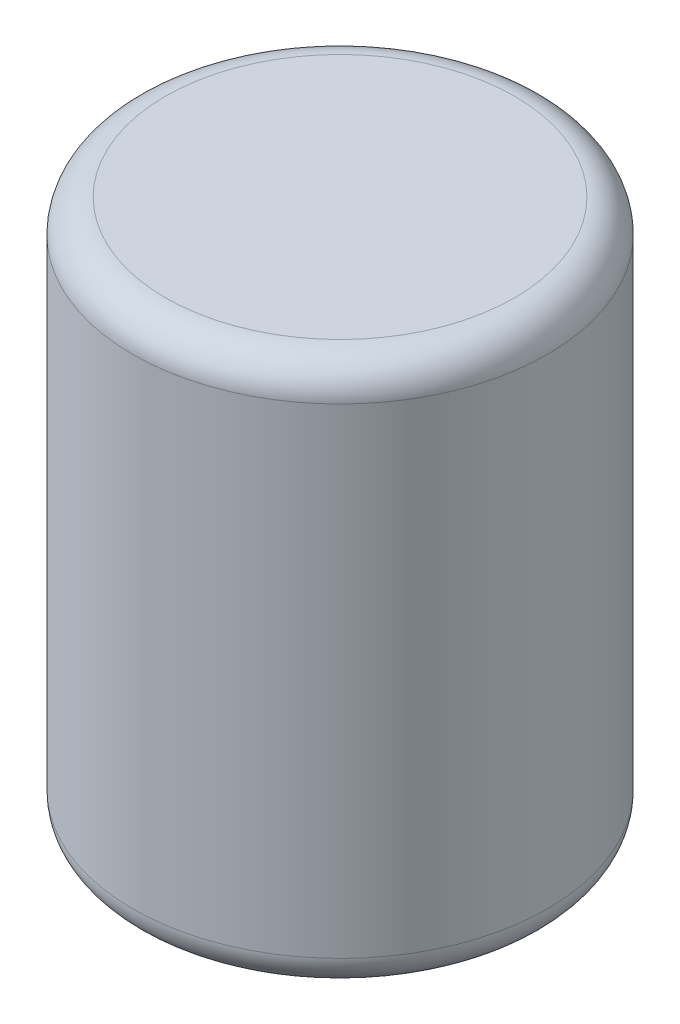
from build123d import *

# Parameters (mm, degrees)
SKETCH_1_R      = 9.5
EXTRUDE_1_DEPTH = 25
FILLET_1_R      = 1.5


with BuildPart() as part:
    # Эскиз1 → Бобышка-Вытянуть1 (new body)
    with BuildSketch(Plane(origin=(0, 0, 0), x_dir=(1, 0, 0), z_dir=(0, 1, 0))):
        with Locations(Location((0, 0, 0), (0, 0, 270))):
            Circle(SKETCH_1_R)
    extrude(amount=EXTRUDE_1_DEPTH)

    # Скругление1
    fillet_1_edges = [part.edges().sort_by_distance(p)[0] for p in [
        (0, 0, -9.5),
        (0, 25, -9.5),
    ]]
    fillet(fillet_1_edges, radius=FILLET_1_R)


solid = part.part
